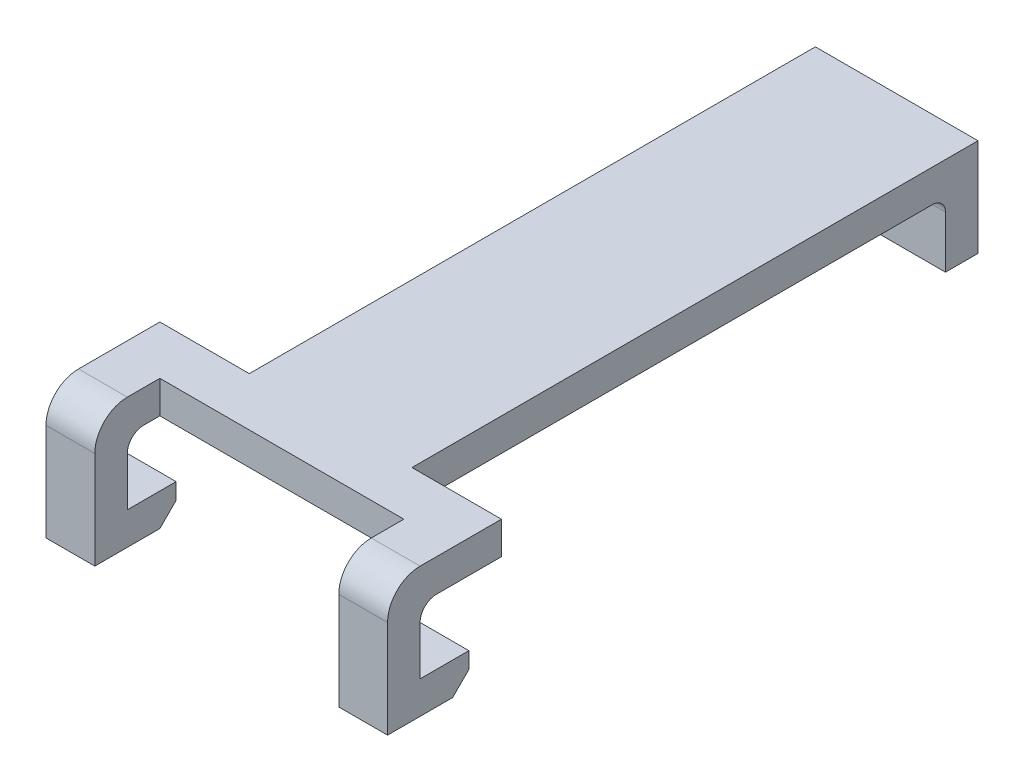
from build123d import *

# Parameters (mm, degrees)
SKETCH1_W           = 10
SKETCH1_H           = 37.8
SKETCH1_W_2         = 5.5
SKETCH1_H_2         = 3
BOSS_EXTRUDE1_DEPTH = 1
SKETCH2_W           = 10
SKETCH2_H           = 2
BOSS_EXTRUDE2_DEPTH = 4
BOSS_EXTRUDE3_START = -10.5
BOSS_EXTRUDE3_DEPTH = 3
BOSS_EXTRUDE4_START = 7.5
BOSS_EXTRUDE4_DEPTH = 3
FILLET1_R           = 0.8


with BuildPart() as part:
    # Sketch1 → Boss-Extrude1 (new, symmetric)
    with BuildSketch(Plane(origin=(0, 0, 0), x_dir=(1, 0, 0), z_dir=(0, 1, 0))):
        Rectangle(SKETCH1_W, SKETCH1_H)
        with Locations((-7.75, -17.4)):
            Rectangle(SKETCH1_W_2, SKETCH1_H_2)
        with Locations((7.75, -17.4)):
            Rectangle(SKETCH1_W_2, SKETCH1_H_2)
    extrude(amount=BOSS_EXTRUDE1_DEPTH, both=True)

    # Sketch2 → Boss-Extrude2 (add)
    with BuildSketch(Plane.XZ.offset(1)):
        with Locations((0, -17.9)):
            Rectangle(SKETCH2_W, SKETCH2_H)
    extrude(amount=BOSS_EXTRUDE2_DEPTH)

    # Sketch3 → Boss-Extrude3 (add)
    with BuildSketch(Plane(origin=(0, 0, 0), x_dir=(0, 0, -1), z_dir=(1, 0, 0)).offset(BOSS_EXTRUDE3_START)):
        with BuildLine():
            Line((-18.9, -7), (-22.9, -7))
            Line((-22.9, -7), (-22.9, -1))
            ThreePointArc((-22.9, -1), (-22.314213562, 0.414213562), (-20.9, 1))
            Line((-20.9, 1), (-18.9, 1))
            Line((-18.9, 1), (-18.9, -1))
            Line((-18.9, -1), (-19.9, -1))
            ThreePointArc((-19.9, -1), (-20.607106781, -1.292893219), (-20.9, -2))
            Line((-20.9, -2), (-20.9, -5))
            Line((-20.9, -5), (-17.9, -5))
            Line((-17.9, -5), (-17.9, -6))
            Line((-17.9, -6), (-18.9, -7))
        make_face()
    extrude(amount=BOSS_EXTRUDE3_DEPTH)

    # Sketch3<3> → Boss-Extrude4 (add)
    with BuildSketch(Plane(origin=(0, 0, 0), x_dir=(0, 0, -1), z_dir=(1, 0, 0)).offset(BOSS_EXTRUDE4_START)):
        with BuildLine():
            Line((-18.9, -7), (-22.9, -7))
            Line((-22.9, -7), (-22.9, -1))
            ThreePointArc((-22.9, -1), (-22.314213562, 0.414213562), (-20.9, 1))
            Line((-20.9, 1), (-18.9, 1))
            Line((-18.9, 1), (-18.9, -1))
            Line((-18.9, -1), (-19.9, -1))
            ThreePointArc((-19.9, -1), (-20.607106781, -1.292893219), (-20.9, -2))
            Line((-20.9, -2), (-20.9, -5))
            Line((-20.9, -5), (-17.9, -5))
            Line((-17.9, -5), (-17.9, -6))
            Line((-17.9, -6), (-18.9, -7))
        make_face()
    extrude(amount=BOSS_EXTRUDE4_DEPTH)

    # Fillet1
    fillet1_edges = [part.edges().sort_by_distance(p)[0] for p in [
        (0, -1, -16.9),
    ]]
    fillet(fillet1_edges, radius=FILLET1_R)


solid = part.part
